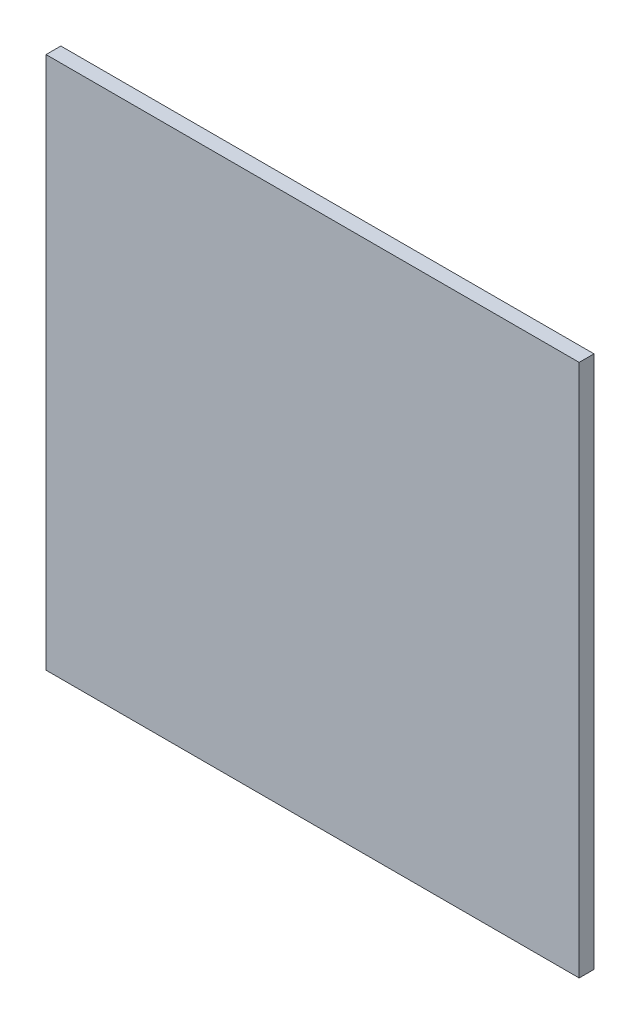
from build123d import *

# Parameters (mm, degrees)
SKETCH1_W           = 180
SKETCH1_H           = 180
BOSS_EXTRUDE1_DEPTH = 5


with BuildPart() as part:
    # Sketch1 → Boss-Extrude1 (new body)
    with BuildSketch(Plane.XY):
        Rectangle(SKETCH1_W, SKETCH1_H)
    extrude(amount=BOSS_EXTRUDE1_DEPTH)


solid = part.part
